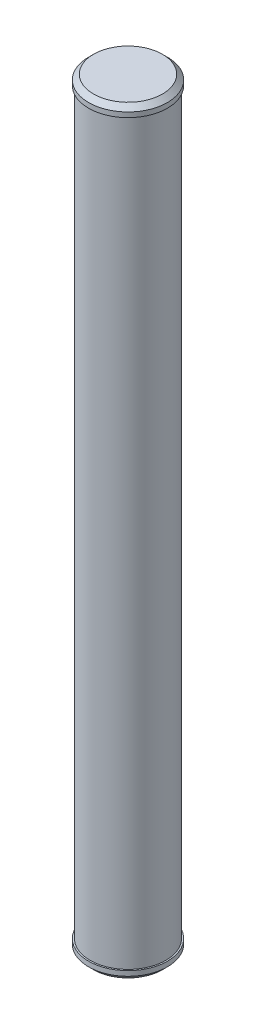
from build123d import *

# Parameters (mm, degrees)
SKETCH_1_R      = 3.85
EXTRUDE_1_DEPTH = 75
SKETCH_3_R      = 4
EXTRUDE_2_DEPTH = 1
EXTRUDE_START   = 1
SKETCH_4_R      = 4
EXTRUDE_3_DEPTH = 1
CHAMFER_1_SIZE  = 0.5


with BuildPart() as part:
    # 草图1 → 凸台-拉伸1 (new body)
    with BuildSketch(Plane(origin=(0, 0, 0), x_dir=(1, 0, 0), z_dir=(0, 1, 0))):
        with Locations(Location((0, 0, 0), (0, 0, 270))):
            Circle(SKETCH_1_R)
    extrude(amount=EXTRUDE_1_DEPTH)

    # 草图3 → 凸台-拉伸2 (add)
    with BuildSketch(Plane(origin=(0, 75, 0), x_dir=(1, 0, 0), z_dir=(0, 1, 0))):
        with Locations(Location((0, 0, 0), (0, 0, 270))):
            Circle(SKETCH_3_R)
    extrude(amount=EXTRUDE_2_DEPTH)

    # 草图4 → 凸台-拉伸3 (add)
    with BuildSketch(Plane.XZ.offset(EXTRUDE_START)):
        with Locations(Location((0, 0, 0), (0, 0, 90))):
            Circle(SKETCH_4_R)
    extrude(amount=-EXTRUDE_3_DEPTH)

    # 倒角1
    chamfer_1_edges = [part.edges().sort_by_distance(p)[0] for p in [
        (0, -1, -4),
        (0, 76, -4),
    ]]
    chamfer(chamfer_1_edges, length=CHAMFER_1_SIZE)


solid = part.part
